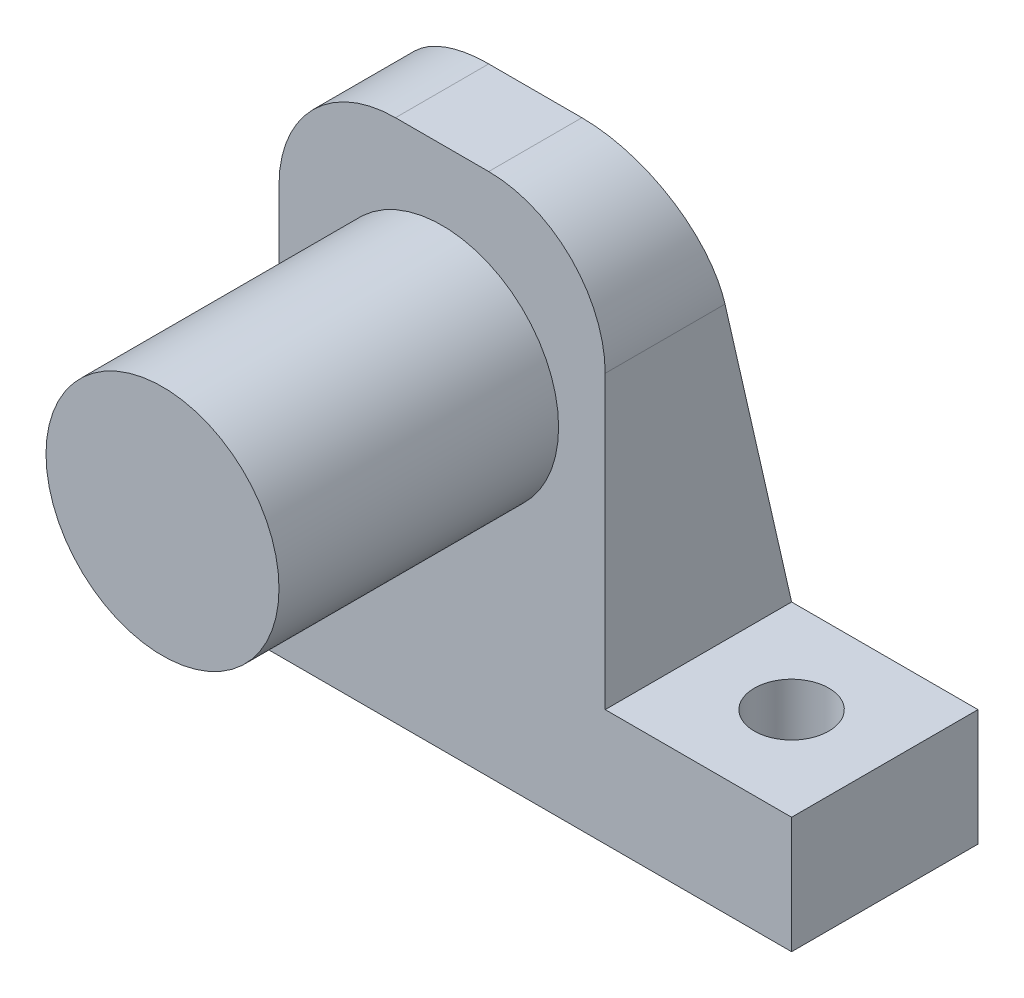
from build123d import *

# Parameters (mm, degrees)
BOSS_EXTRUDE2_DEPTH     = 8
SKETCH2_R               = 1.6
CUT_EXTRUDE1_DEPTH      = 8
SKETCH3_R               = 5
BOSS_EXTRUDE3_DEPTH     = 12
CUT_EXTRUDE3_DEPTH      = 43.5
CUT_EXTRUDE3_DEPTH_BACK = 43.5


with BuildPart() as part:
    # Sketch1 → Boss-Extrude2 (new body)
    with BuildSketch(Plane.XY):
        with BuildLine():
            Line((0, 0), (-15, 0))
            Line((-15, 0), (-15, 5))
            Line((-15, 5), (-7, 5))
            Line((-7, 5), (-7, 17.5))
            ThreePointArc((-7, 17.5), (-5.535533906, 21.035533906), (-2, 22.5))
            Line((-2, 22.5), (2, 22.5))
            ThreePointArc((2, 22.5), (5.535533906, 21.035533906), (7, 17.5))
            Line((7, 17.5), (7, 5))
            Line((7, 5), (15, 5))
            Line((15, 5), (15, 0))
            Line((15, 0), (0, 0))
        make_face()
    extrude(amount=BOSS_EXTRUDE2_DEPTH)

    # Sketch2 → Cut-Extrude1 (cut)
    with BuildSketch(Plane(origin=(0, 5, 0), x_dir=(1, 0, 0), z_dir=(0, 1, 0))):
        with Locations((-11, -4)):
            Circle(SKETCH2_R)
        with Locations((11, -4)):
            Circle(SKETCH2_R)
    extrude(amount=-CUT_EXTRUDE1_DEPTH, mode=Mode.SUBTRACT)

    # Sketch3 → Boss-Extrude3 (add)
    with BuildSketch(Plane.XY.offset(8)):
        with Locations((0, 14.5)):
            Circle(SKETCH3_R)
    extrude(amount=BOSS_EXTRUDE3_DEPTH)

    # Sketch8 → Cut-Extrude3 (cut, two sides: drawn at the far end of the back side and taken through both)
    with BuildSketch(Plane.ZY.offset(15).offset(-CUT_EXTRUDE3_DEPTH_BACK)):
        Polygon((-14.53213237, -58.578079117), (0, 5), (4, 22.5), (18.53213237, 86.078079117), (-108.624025864, 115.142343856), (-141.688290603, -29.513814378), align=None)
    extrude(amount=CUT_EXTRUDE3_DEPTH + CUT_EXTRUDE3_DEPTH_BACK, mode=Mode.SUBTRACT)


solid = part.part
